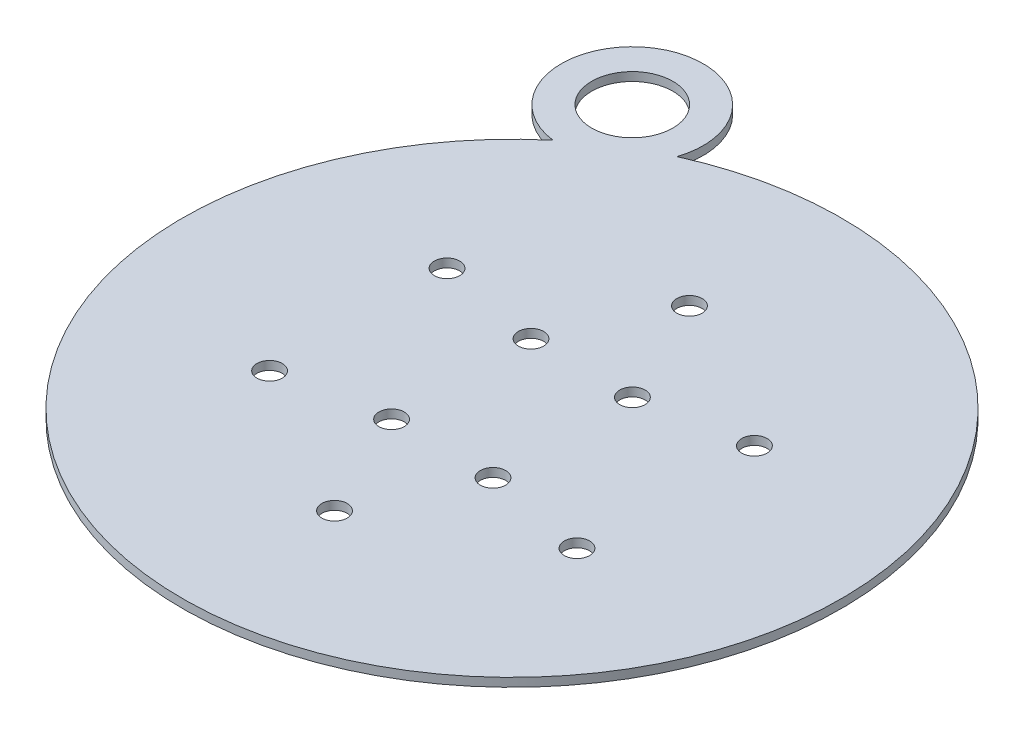
from build123d import *

# Parameters (mm, degrees)
SKETCH1_R           = 65
SKETCH1_R_2         = 2.5
SKETCH1_R_3         = 14
SKETCH1_R_4         = 8
BOSS_EXTRUDE1_DEPTH = 1.7


with BuildPart() as part:
    # Sketch1 → Boss-Extrude1 (new body)
    # profile 1 of 2: a face of its own
    with BuildSketch(Plane(origin=(0, 0, 0), x_dir=(1, 0, 0), z_dir=(0, 1, 0))):
        Circle(SKETCH1_R)
        with Locations(Location((-10, 13.75, 0), (0, 0, 270))):
            Circle(SKETCH1_R_2, mode=Mode.SUBTRACT)
        with Locations(Location((10, 13.75, 0), (0, 0, 270))):
            Circle(SKETCH1_R_2, mode=Mode.SUBTRACT)
        with Locations(Location((10, -13.75, 0), (0, 0, 270))):
            Circle(SKETCH1_R_2, mode=Mode.SUBTRACT)
        with Locations(Location((-10, -13.75, 0), (0, 0, 270))):
            Circle(SKETCH1_R_2, mode=Mode.SUBTRACT)
        with Locations(Location((0, 35, 0), (0, 0, 270))):
            Circle(SKETCH1_R_2, mode=Mode.SUBTRACT)
        with Locations(Location((30.310889132, 17.5, 0), (0, 0, 270))):
            Circle(SKETCH1_R_2, mode=Mode.SUBTRACT)
        with Locations(Location((30.310889132, -17.5, 0), (0, 0, 270))):
            Circle(SKETCH1_R_2, mode=Mode.SUBTRACT)
        with Locations(Location((0, -35, 0), (0, 0, 270))):
            Circle(SKETCH1_R_2, mode=Mode.SUBTRACT)
        with Locations(Location((-30.310889132, -17.5, 0), (0, 0, 270))):
            Circle(SKETCH1_R_2, mode=Mode.SUBTRACT)
        with Locations(Location((-30.310889132, 17.5, 0), (0, 0, 270))):
            Circle(SKETCH1_R_2, mode=Mode.SUBTRACT)
    # profile 2 of 2: a face of its own
    with BuildSketch(Plane(origin=(0, 0, 0), x_dir=(1, 0, 0), z_dir=(0, 1, 0))):
        with Locations((-40, 63.718686589)):
            Circle(SKETCH1_R_3)
        with Locations(Location((-40, 63.718686589, 0), (0, 0, 270))):
            Circle(SKETCH1_R_4, mode=Mode.SUBTRACT)
    extrude(amount=BOSS_EXTRUDE1_DEPTH)


solid = part.part
